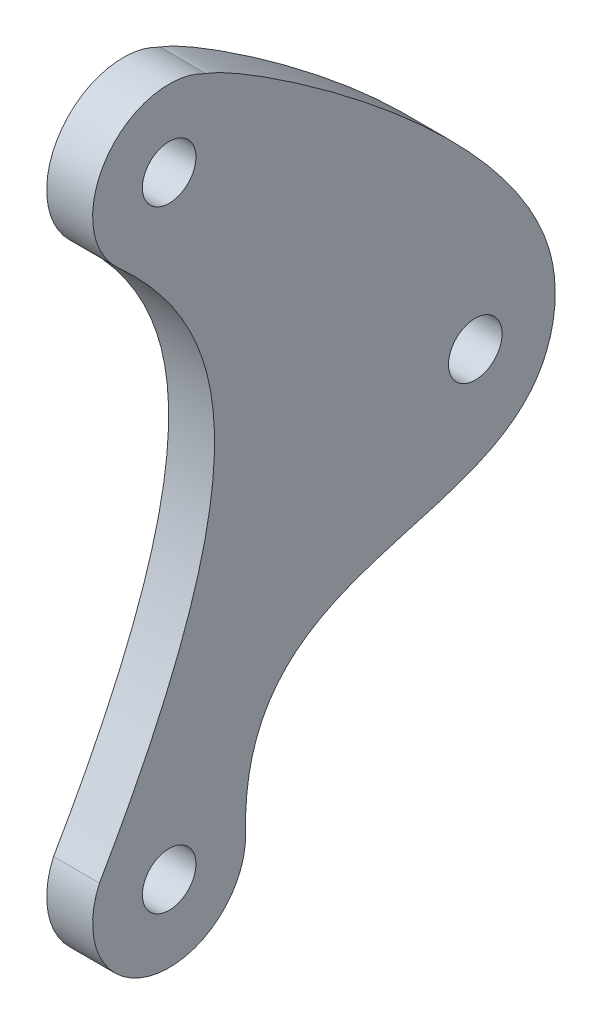
from build123d import *

# Parameters (mm, degrees)
CROQUIS1_R              = 1.75
SALIENTE_EXTRUIR2_DEPTH = 3


with BuildPart() as part:
    # Croquis1 → Saliente-Extruir2 (new body)
    with BuildSketch(Plane(origin=(0, 0, 0), x_dir=(0, 0, -1), z_dir=(1, 0, 0))):
        with BuildLine():
            ThreePointArc((-24.552322054, -17.932062883), (-21.057920066, -24.886799068), (-15, -20))
            add(Edge.make_bspline(
                [(-15, -20), (-15.466760547, -5.270966712), (3.897936139, -11.668910874), (6.648630912, 9.647963486), (-15.563211903, 23.896857347), (-17.552150511, 24.359820281)],
                knots=[0, 0, 0, 0, 0.482956451, 0.582956451, 1, 1, 1, 1], degree=3))
            ThreePointArc((-17.552150511, 24.359820281), (-23.997039566, 23.003943193), (-23.507065356, 16.436224953))
            add(Edge.make_bspline(
                [(-24.552322054, -17.932062883), (-13.483033173, 1.193565845), (-15.941216968, 9.612334544), (-23.507065356, 16.436224953)],
                knots=[0, 0, 0, 0, 1, 1, 1, 1], degree=3))
        make_face()
        with Locations((-20, 20)):
            Circle(CROQUIS1_R, mode=Mode.SUBTRACT)
        Circle(CROQUIS1_R, mode=Mode.SUBTRACT)
        with Locations((-20, -20)):
            Circle(CROQUIS1_R, mode=Mode.SUBTRACT)
    extrude(amount=SALIENTE_EXTRUIR2_DEPTH)


solid = part.part
